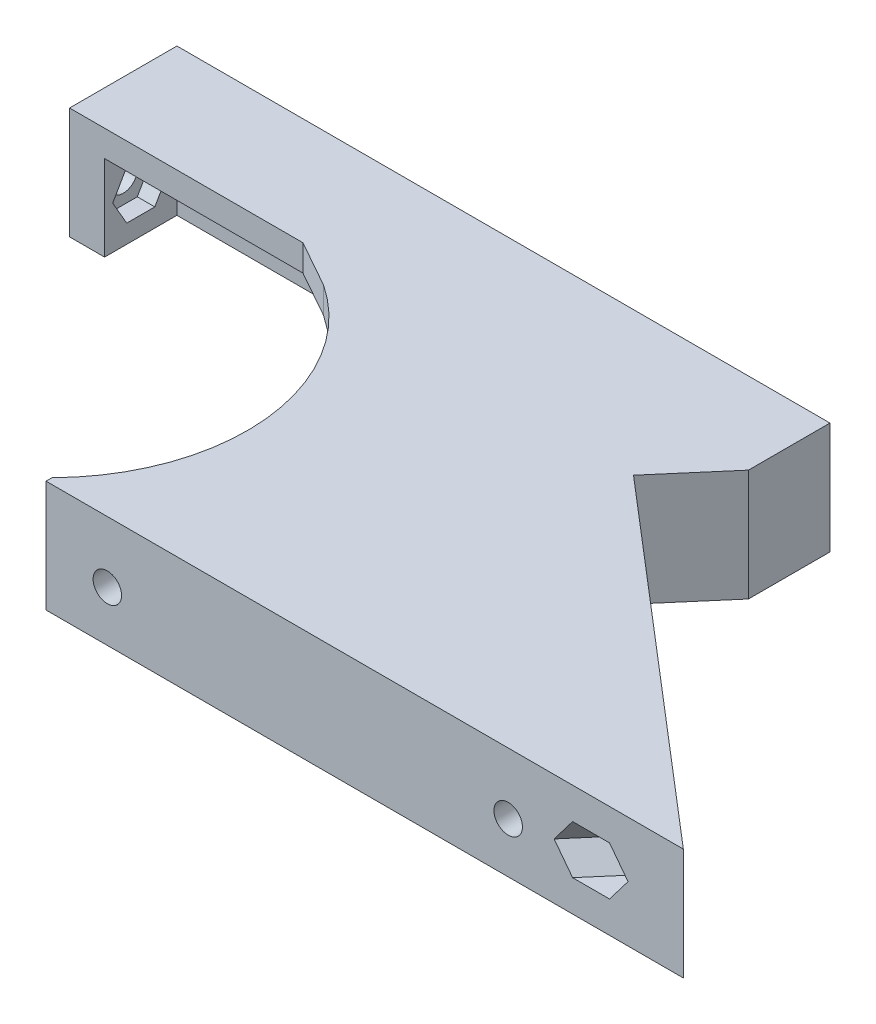
from build123d import *

# Parameters (mm, degrees)
SALIENTE_EXTRUIR1_DEPTH     = 12.75
CORTAR_EXTRUIR1_REACH       = 81.607
CROQUIS2_R                  = 1.625
CROQUIS3_R                  = 22.5
CORTAR_EXTRUIR2_DEPTH       = 80.607327513
SALIENTE_EXTRUIR2_DEPTH     = 3
SALIENTE_EXTRUIR3_DEPTH     = 9.75
CROQUIS6_R                  = 1.625
CORTAR_EXTRUIR3_DEPTH       = 10
CORTAR_EXTRUIR4_START       = -2
CORTAR_EXTRUIR4_DEPTH       = 10
CORTAR_EXTRUIR5_START       = -2
CORTAR_EXTRUIR5_DEPTH       = 10
CORTAR_EXTRUIR6_DEPTH       = 2
CORTAR_EXTRUIR7_REACH       = 83.869
CROQUIS10_R                 = 1.625
CORTAR_EXTRUIR8_DEPTH       = 2
CORTAR_EXTRUIR9_DEPTH       = 82.868914705
CORTAR_EXTRUIR9_DEPTH_BACK  = 82.868914705
CROQUIS12_W                 = 92.508691999
CROQUIS12_H                 = 24.255818813
SALIENTE_EXTRUIR4_DEPTH     = 12.75
CORTAR_EXTRUIR10_START      = -9.75
CORTAR_EXTRUIR10_DEPTH      = 9.75
CROQUIS16_W                 = 68.039065087
CROQUIS16_H                 = 12.75
CORTAR_EXTRUIR11_DEPTH      = 1
CORTAR_EXTRUIR12_DEPTH      = 111.665490574
CORTAR_EXTRUIR12_DEPTH_BACK = 111.665490574
CROQUIS17_W                 = 40.657498706
CROQUIS17_H                 = 22.934549925
SALIENTE_EXTRUIR5_REACH     = 98.215
CROQUIS18_W                 = 34.9120451
CROQUIS18_H                 = 3.951156815
CROQUIS20_R                 = 1.625
CORTAR_EXTRUIR14_DEPTH      = 10
CORTAR_EXTRUIR15_DEPTH      = 1.999995
CROQUIS22_R                 = 1.625
CORTAR_EXTRUIR16_DEPTH      = 10
CORTAR_EXTRUIR17_DEPTH      = 2
SALIENTE_EXTRUIR6_DEPTH     = 12.75
CORTAR_EXTRUIR18_DEPTH      = 2
CROQUIS28_R                 = 1.625
SALIENTE_EXTRUIR7_DEPTH     = 1
CORTAR_EXTRUIR19_REACH      = 127.295
CROQUIS29_R                 = 1.625
CORTAR_EXTRUIR20_DEPTH      = 2
SALIENTE_EXTRUIR11_DEPTH    = 12.75
CROQUIS41_R                 = 1.625
CORTAR_EXTRUIR25_DEPTH      = 10
SALIENTE_EXTRUIR12_DEPTH    = 12.75
SALIENTE_EXTRUIR13_DEPTH    = 12.75
CORTAR_EXTRUIR26_DEPTH      = 97.215343507
SALIENTE_EXTRUIR14_REACH    = 91.506
SALIENTE_EXTRUIR15_REACH    = 91.506
CORTAR_EXTRUIR27_REACH      = 122.22
CROQUIS47_R                 = 1.625
CORTAR_EXTRUIR28_REACH      = 124.22
CORTAR_EXTRUIR28_START      = -2
CORTAR_EXTRUIR29_START      = -9.75
CORTAR_EXTRUIR29_DEPTH      = 9.75
CORTAR_EXTRUIR30_REACH      = 91.506
CROQUIS50_R                 = 1.625
CORTAR_EXTRUIR31_REACH      = 93.506
CORTAR_EXTRUIR31_START      = -2
CORTAR_EXTRUIR13_DEPTH      = 99.717170878
CORTAR_EXTRUIR13_DEPTH_BACK = 99.717170878
CROQUIS19_W                 = 120.448667976
CROQUIS19_H                 = 32.886651308


with BuildPart() as part:
    # Croquis1 → Saliente-Extruir1 (new body)
    with BuildSketch(Plane(origin=(0, 0, 0), x_dir=(1, 0, 0), z_dir=(0, 1, 0))):
        Polygon((0, 0), (72.78319995, 0), (38.224450787, 29.62043043), (35.621353918, 26.5833452), (60.803074847, 5), (0, 5), align=None)
    extrude(amount=SALIENTE_EXTRUIR1_DEPTH)

    # Croquis2 → Cortar-Extruir1 (cut, up to next)
    with BuildSketch(Plane.XY, mode=Mode.PRIVATE) as cortar_extruir1_sk1:
        with Locations((52.78319995, 5.75)):
            Circle(CROQUIS2_R)
    cortar_extruir1_tool1 = extrude(cortar_extruir1_sk1.sketch, amount=-CORTAR_EXTRUIR1_REACH, mode=Mode.PRIVATE) & part.part
    # Croquis2 → Cortar-Extruir1 (cut, up to next)
    with BuildSketch(Plane.XY, mode=Mode.PRIVATE) as cortar_extruir1_sk2:
        with Locations((6.99999995, 5.75)):
            Circle(CROQUIS2_R)
    cortar_extruir1_tool2 = extrude(cortar_extruir1_sk2.sketch, amount=-CORTAR_EXTRUIR1_REACH, mode=Mode.PRIVATE) & part.part
    add(cortar_extruir1_tool1.solids().sort_by_distance((52.7832, 5.75, 0))[0], mode=Mode.SUBTRACT)
    add(cortar_extruir1_tool2.solids().sort_by_distance((7, 5.75, 0))[0], mode=Mode.SUBTRACT)

    # Croquis3 → Cortar-Extruir2 (cut, through all)
    with BuildSketch(Plane(origin=(0, 12.75, 0), x_dir=(1, 0, 0), z_dir=(0, 1, 0))):
        with Locations((-16, 16.5)):
            Circle(CROQUIS3_R)
    extrude(amount=-CORTAR_EXTRUIR2_DEPTH, mode=Mode.SUBTRACT)

    # Croquis4 → Saliente-Extruir2 (add)
    with BuildSketch(Plane(origin=(0, 12.75, 0), x_dir=(1, 0, 0), z_dir=(0, 1, 0))):
        with BuildLine():
            Line((38.224450787, 29.62043043), (31.656319269, 35.25))
            Line((31.656319269, 35.25), (-3.562657036, 35.25))
            ThreePointArc((-3.562657036, 35.25), (5.936291456, 21.504909307), (3.339079606, 5))
            Line((3.339079606, 5), (60.803074847, 5))
            Line((60.803074847, 5), (35.621353918, 26.5833452))
            Line((35.621353918, 26.5833452), (38.224450787, 29.62043043))
        make_face()
    extrude(amount=-SALIENTE_EXTRUIR2_DEPTH)

    # Croquis5 → Saliente-Extruir3 (add)
    with BuildSketch(Plane.XZ.offset(-9.75)):
        with BuildLine():
            Line((-3.562657036, -35.25), (31.656319269, -35.25))
            Line((31.656319269, -35.25), (38.224450787, -29.62043043))
            Line((38.224450787, -29.62043043), (35.621353918, -26.5833452))
            Line((35.621353918, -26.5833452), (30.17667434, -31.25))
            Line((30.17667434, -31.25), (0.990806338, -31.25))
            ThreePointArc((0.990806338, -31.25), (-1.15062315, -33.404023402), (-3.562657036, -35.25))
        make_face()
    extrude(amount=SALIENTE_EXTRUIR3_DEPTH)

    # Croquis6 → Cortar-Extruir3 (cut)
    with BuildSketch(Plane(origin=(30.824200619, 0, -35.963211942), x_dir=(-0.7592713073348843, 0, -0.6507742172658468), z_dir=(0.6507742172658468, 0, -0.7592713073348843))):
        with Locations((-47.262195378, 6.375)):
            Circle(CROQUIS6_R)
        with Locations((-7.442195378, 6.375)):
            Circle(CROQUIS6_R)
    extrude(amount=-CORTAR_EXTRUIR3_DEPTH, mode=Mode.SUBTRACT)

    # Croquis7 → Cortar-Extruir4 (cut)
    with BuildSketch(Plane(origin=(28.22110375, 0, -32.926126712), x_dir=(0.7592713073348848, 0, 0.6507742172658464), z_dir=(-0.6507742172658463, 0, 0.7592713073348847)).offset(CORTAR_EXTRUIR4_START)):
        Polygon((48.864342375, 3.6), (50.466489372, 6.375), (48.864342375, 9.15), (45.660048381, 9.15), (44.057901384, 6.375), (45.660048381, 3.6), align=None)
    extrude(amount=CORTAR_EXTRUIR4_DEPTH, mode=Mode.SUBTRACT)

    # Croquis8 → Cortar-Extruir5 (cut)
    with BuildSketch(Plane(origin=(28.22110375, 0, -32.926126712), x_dir=(0.7592713073348848, 0, 0.6507742172658464), z_dir=(-0.6507742172658463, 0, 0.7592713073348847)).offset(CORTAR_EXTRUIR5_START)):
        Polygon((9.044342375, 3.6), (10.646489372, 6.375), (9.044342375, 9.15), (5.840048381, 9.15), (4.237901384, 6.375), (5.840048381, 3.6), align=None)
    extrude(amount=CORTAR_EXTRUIR5_DEPTH, mode=Mode.SUBTRACT)

    # Croquis9 → Cortar-Extruir6 (cut)
    with BuildSketch(Plane(origin=(0, 0, -5), x_dir=(-1, 0, 0), z_dir=(0, 0, -1))):
        Polygon((-5.397852953, 2.975), (-3.795705956, 5.75), (-5.397852953, 8.525), (-8.602146947, 8.525), (-10.204293944, 5.75), (-8.602146947, 2.975), align=None)
        Polygon((-51.181052953, 2.975), (-49.578905956, 5.75), (-51.181052953, 8.525), (-54.385346947, 8.525), (-55.987493944, 5.75), (-54.385346947, 2.975), align=None)
    extrude(amount=-CORTAR_EXTRUIR6_DEPTH, mode=Mode.SUBTRACT)

    # Croquis10 → Cortar-Extruir7 (cut, up to next)
    with BuildSketch(Plane(origin=(0, 0, -35.25), x_dir=(-1, 0, 0), z_dir=(0, 0, -1)), mode=Mode.PRIVATE) as cortar_extruir7_sk1:
        with Locations((-21.656319269, 6.375)):
            Circle(CROQUIS10_R)
    cortar_extruir7_tool1 = extrude(cortar_extruir7_sk1.sketch, amount=-CORTAR_EXTRUIR7_REACH, mode=Mode.PRIVATE) & part.part
    add(cortar_extruir7_tool1.solids().sort_by_distance((21.656319, 6.375, -35.25))[0], mode=Mode.SUBTRACT)

    # Croquis11 → Cortar-Extruir8 (cut)
    with BuildSketch(Plane.XY.offset(-31.25)):
        Polygon((23.258466266, 3.6), (24.860613263, 6.375), (23.258466266, 9.15), (20.054172272, 9.15), (18.452025275, 6.375), (20.054172272, 3.6), align=None)
    extrude(amount=-CORTAR_EXTRUIR8_DEPTH, mode=Mode.SUBTRACT)

    # Simetría1: part across plane


with BuildPart() as part_1:
    add(part.part)
    add(part.part.mirror(Plane.ZX))

    # Croquis12 → Cortar-Extruir9 (cut, two sides: drawn at the far end of the back side and taken through both)
    with BuildSketch(Plane(origin=(0, 0, -35.25), x_dir=(-1, 0, 0), z_dir=(0, 0, -1)).offset(-CORTAR_EXTRUIR9_DEPTH_BACK)):
        with Locations((-33.077560565, 12.127909407)):
            Rectangle(CROQUIS12_W, CROQUIS12_H)
    extrude(amount=CORTAR_EXTRUIR9_DEPTH + CORTAR_EXTRUIR9_DEPTH_BACK, mode=Mode.SUBTRACT)

    # Croquis13 → Saliente-Extruir4 (add)
    with BuildSketch(Plane.XZ.offset(12.75)):
        Polygon((-35.562657036, -82.38260805), (-35.562657036, -38.25), (-8.913300435, -38.25), (-3.562657036, -35.25), (31.656319269, -35.25), (0.000162281, -62.38260805), align=None)
    extrude(amount=-SALIENTE_EXTRUIR4_DEPTH)

    # Croquis14 → Cortar-Extruir10 (cut)
    with BuildSketch(Plane(origin=(0, 0, 0), x_dir=(1, 0, 0), z_dir=(0, 1, 0)).offset(CORTAR_EXTRUIR10_START)):
        Polygon((30.17667434, 31.25), (0.990806338, 31.25), (-31.562657036, 38.25), (-31.562657036, 75.543902968), (-2.303881466, 59.089203295), align=None)
    extrude(amount=CORTAR_EXTRUIR10_DEPTH, mode=Mode.SUBTRACT)

    # Croquis16 → Cortar-Extruir11 (cut)
    with BuildSketch(Plane(origin=(30.824200619, 0, -35.963211942), x_dir=(-0.7592713073348843, 0, -0.6507742172658468), z_dir=(0.6507742172658468, 0, -0.7592713073348843))):
        with Locations((6.577337166, -6.375)):
            Rectangle(CROQUIS16_W, CROQUIS16_H)
    extrude(amount=-CORTAR_EXTRUIR11_DEPTH, mode=Mode.SUBTRACT)

    # Croquis17 → Cortar-Extruir12 (cut, two sides: drawn at the far end of the back side and taken through both)
    with BuildSketch(Plane.XZ.offset(12.75).offset(-CORTAR_EXTRUIR12_DEPTH_BACK)):
        with Locations((-20.328587072, -73.090611706)):
            Rectangle(CROQUIS17_W, CROQUIS17_H)
    extrude(amount=CORTAR_EXTRUIR12_DEPTH + CORTAR_EXTRUIR12_DEPTH_BACK, mode=Mode.SUBTRACT)

    # Croquis18 → Saliente-Extruir5 (add, up to next)
    with BuildSketch(Plane(origin=(0, 0, 0), x_dir=(1, 0, 0), z_dir=(0, 1, 0)), mode=Mode.PRIVATE) as saliente_extruir5_sk1:
        with Locations((-18.106634486, 59.647758336)):
            Rectangle(CROQUIS18_W, CROQUIS18_H)
    saliente_extruir5_tool1 = extrude(saliente_extruir5_sk1.sketch, amount=-SALIENTE_EXTRUIR5_REACH, mode=Mode.PRIVATE) - part_1.part
    add(saliente_extruir5_tool1.solids().sort_by_distance((-18.106634, 0, -59.647758))[0])

    # Croquis20 → Cortar-Extruir14 (cut)
    with BuildSketch(Plane(origin=(30.173426402, 0, -35.203940634), x_dir=(-0.7592713073348842, 0, -0.6507742172658472), z_dir=(0.6507742172658472, 0, -0.7592713073348842))):
        with Locations((25.596869709, -6.375)):
            Circle(CROQUIS20_R)
        with Locations((-7.442195378, -6.375)):
            Circle(CROQUIS20_R)
    extrude(amount=-CORTAR_EXTRUIR14_DEPTH, mode=Mode.SUBTRACT)

    # Croquis21 → Cortar-Extruir15 (cut)
    with BuildSketch(Plane(origin=(28.22110375, 0, -32.926126712), x_dir=(0.7592713073348848, 0, 0.6507742172658464), z_dir=(-0.6507742172658463, 0, 0.7592713073348847))):
        Polygon((-23.994722712, -9.15), (-22.392575715, -6.375), (-23.994722712, -3.6), (-27.199016706, -3.6), (-28.801163703, -6.375), (-27.199016706, -9.15), align=None)
    extrude(amount=-CORTAR_EXTRUIR15_DEPTH, mode=Mode.SUBTRACT)

    # Croquis22 → Cortar-Extruir16 (cut)
    with BuildSketch(Plane(origin=(0, 0, -61.623336743), x_dir=(-1, 0, 0), z_dir=(0, 0, -1))):
        with Locations((18.112657036, -6.375)):
            Circle(CROQUIS22_R)
    extrude(amount=-CORTAR_EXTRUIR16_DEPTH, mode=Mode.SUBTRACT)

    # Croquis23 → Cortar-Extruir17 (cut)
    with BuildSketch(Plane.XY.offset(-57.672179928)):
        Polygon((-16.510510039, -9.15), (-14.908363042, -6.375), (-16.510510039, -3.6), (-19.714804033, -3.6), (-21.31695103, -6.375), (-19.714804033, -9.15), align=None)
    extrude(amount=-CORTAR_EXTRUIR17_DEPTH, mode=Mode.SUBTRACT)

    # Croquis26 → Saliente-Extruir6 (add)
    with BuildSketch(Plane(origin=(0, 0, 0), x_dir=(1, 0, 0), z_dir=(0, 1, 0))):
        Polygon((60.803074847, 5), (-2.287792345, 59.07541325), (-2.938566562, 58.316141943), (60.15230063, 4.240728693), align=None)
    extrude(amount=-SALIENTE_EXTRUIR6_DEPTH)

    # Croquis27 → Cortar-Extruir18 (cut)
    with BuildSketch(Plane(origin=(27.570329533, 0, -32.166855405), x_dir=(0.7592713073348847, 0, 0.6507742172658465), z_dir=(-0.6507742172658465, 0, 0.7592713073348848))):
        Polygon((-22.421443229, -6.375), (-24.009156469, -3.625), (-27.184582949, -3.625), (-28.77229619, -6.375), (-27.184582949, -9.125), (-24.009156469, -9.125), align=None)
        Polygon((10.646489372, -6.375), (9.044342375, -3.6), (5.840048381, -3.6), (4.237901384, -6.375), (5.840048381, -9.15), (9.044342375, -9.15), align=None)
    extrude(amount=-CORTAR_EXTRUIR18_DEPTH, mode=Mode.SUBTRACT)

    # Croquis28 → Saliente-Extruir7 (add)
    # profile 1 of 2: a face of its own
    with BuildSketch(Plane(origin=(29.522652185, 0, -34.444669327), x_dir=(0.7592713073348847, 0, 0.6507742172658465), z_dir=(-0.6507742172658465, 0, 0.7592713073348848))):
        Polygon((-24.009156469, -3.625), (-27.184582949, -3.625), (-28.77229619, -6.375), (-27.184582949, -9.125), (-24.009156469, -9.125), (-22.421443229, -6.375), align=None)
        with Locations(Location((-25.596869709, -6.375, 0), (0, 0, 180))):
            Circle(CROQUIS28_R, mode=Mode.SUBTRACT)
    # profile 2 of 2: a face of its own
    with BuildSketch(Plane(origin=(29.522652185, 0, -34.444669327), x_dir=(0.7592713073348847, 0, 0.6507742172658465), z_dir=(-0.6507742172658465, 0, 0.7592713073348848))):
        Polygon((10.646489372, -6.375), (9.044342375, -3.6), (5.840048381, -3.6), (4.237901384, -6.375), (5.840048381, -9.15), (9.044342375, -9.15), align=None)
        with Locations(Location((7.442195378, -6.375, 0), (0, 0, 180))):
            Circle(CROQUIS28_R, mode=Mode.SUBTRACT)
    extrude(amount=SALIENTE_EXTRUIR7_DEPTH)

    # Croquis29 → Cortar-Extruir19 (cut, up to next)
    with BuildSketch(Plane.ZY.offset(35.562657036), mode=Mode.PRIVATE) as cortar_extruir19_sk1:
        with Locations((-51.623336743, -6.375)):
            Circle(CROQUIS29_R)
    cortar_extruir19_tool1 = extrude(cortar_extruir19_sk1.sketch, amount=-CORTAR_EXTRUIR19_REACH, mode=Mode.PRIVATE) & part_1.part
    add(cortar_extruir19_tool1.solids().sort_by_distance((-35.562657, -6.375, -51.623337))[0], mode=Mode.SUBTRACT)

    # Croquis30 → Cortar-Extruir20 (cut)
    with BuildSketch(Plane(origin=(-31.562657036, 0, 0), x_dir=(0, 0, -1), z_dir=(1, 0, 0))):
        Polygon((53.22548374, -9.15), (54.827630737, -6.375), (53.22548374, -3.6), (50.021189746, -3.6), (48.419042749, -6.375), (50.021189746, -9.15), align=None)
    extrude(amount=-CORTAR_EXTRUIR20_DEPTH, mode=Mode.SUBTRACT)

    # Croquis40 → Saliente-Extruir11 (add)
    with BuildSketch(Plane.XZ.offset(12.75)):
        Polygon((51.009497963, -17.345267417), (-0.650611936, -61.623336743), (0.886019316, -61.623336743), (51.66027218, -18.104538724), align=None)
    extrude(amount=-SALIENTE_EXTRUIR11_DEPTH)

    # Croquis41 → Cortar-Extruir25 (cut)
    with BuildSketch(Plane(origin=(30.824200619, 0, -35.963211942), x_dir=(-0.7592713073348843, 0, -0.6507742172658468), z_dir=(0.6507742172658468, 0, -0.7592713073348843))):
        with Locations((-7.442195378, -6.375)):
            Circle(CROQUIS41_R)
        with Locations((25.596869709, -6.375)):
            Circle(CROQUIS41_R)
    extrude(amount=-CORTAR_EXTRUIR25_DEPTH, mode=Mode.SUBTRACT)

    # Croquis42 → Saliente-Extruir12 (add)
    with BuildSketch(Plane.XZ.offset(12.75)):
        Polygon((32.95941988, -34.133107696), (39.018127843, -41.201923567), (24.71209089, -41.201923567), align=None)
    extrude(amount=-SALIENTE_EXTRUIR12_DEPTH)

    # Croquis43 → Saliente-Extruir13 (add)
    with BuildSketch(Plane.XZ.offset(12.75)):
        Polygon((39.018127843, -41.201923567), (39.018127843, -50.511923567), (13.849927511, -50.511923567), (24.71209089, -41.201923567), align=None)
    extrude(amount=-SALIENTE_EXTRUIR13_DEPTH)

    # Croquis44 → Cortar-Extruir26 (cut, through all)
    with BuildSketch(Plane.XZ.offset(12.75)):
        Polygon((13.849927511, -50.511923567), (-35.562657036, -50.511923567), (-35.562657036, -61.623336743), (0.886019316, -61.623336743), align=None)
    extrude(amount=-CORTAR_EXTRUIR26_DEPTH, mode=Mode.SUBTRACT)

    # Croquis45 → Saliente-Extruir14 (add, up to next)
    with BuildSketch(Plane(origin=(0, 0, 0), x_dir=(1, 0, 0), z_dir=(0, 1, 0)), mode=Mode.PRIVATE) as saliente_extruir14_sk1:
        Polygon((6.166771253, 50.511923567), (21.724093533, 50.511923567), (21.724093533, 37.177685684), align=None)
    saliente_extruir14_tool1 = extrude(saliente_extruir14_sk1.sketch, amount=-SALIENTE_EXTRUIR14_REACH, mode=Mode.PRIVATE) - part_1.part
    add(saliente_extruir14_tool1.solids().sort_by_distance((16.538319, 0, -46.067178))[0])

    # Croquis46 → Saliente-Extruir15 (add, up to next)
    with BuildSketch(Plane(origin=(0, 0, 0), x_dir=(1, 0, 0), z_dir=(0, 1, 0)), mode=Mode.PRIVATE) as saliente_extruir15_sk1:
        Polygon((-35.562657036, 50.511923567), (-31.562657036, 50.511923567), (10.83365133, 50.511923567), (10.83365133, 46.511923567), (-31.562657036, 46.511923567), (-31.562657036, 38.25), (-35.562657036, 38.25), align=None)
    saliente_extruir15_tool1 = extrude(saliente_extruir15_sk1.sketch, amount=-SALIENTE_EXTRUIR15_REACH, mode=Mode.PRIVATE) - part_1.part
    add(saliente_extruir15_tool1.solids().sort_by_distance((-15.568733, 0, -47.585191))[0])

    # Croquis47 → Cortar-Extruir27 (cut, up to next)
    with BuildSketch(Plane.ZY.offset(35.562657036), mode=Mode.PRIVATE) as cortar_extruir27_sk1:
        with Locations((-42.380961783, -4.875)):
            Circle(CROQUIS47_R)
    cortar_extruir27_tool1 = extrude(cortar_extruir27_sk1.sketch, amount=-CORTAR_EXTRUIR27_REACH, mode=Mode.PRIVATE) & part_1.part
    add(cortar_extruir27_tool1.solids().sort_by_distance((-35.562657, -4.875, -42.380962))[0], mode=Mode.SUBTRACT)

    # Croquis48 → Cortar-Extruir28 (cut, up to next)
    with BuildSketch(Plane.ZY.offset(35.562657036).offset(CORTAR_EXTRUIR28_START), mode=Mode.PRIVATE) as cortar_extruir28_sk1:
        Polygon((-40.778814786, -7.65), (-39.176667789, -4.875), (-40.778814786, -2.1), (-43.98310878, -2.1), (-45.585255777, -4.875), (-43.98310878, -7.65), align=None)
    cortar_extruir28_tool1 = extrude(cortar_extruir28_sk1.sketch, amount=-CORTAR_EXTRUIR28_REACH, mode=Mode.PRIVATE) & part_1.part
    add(cortar_extruir28_tool1.solids().sort_by_distance((-33.562657, -4.875, -42.380962))[0], mode=Mode.SUBTRACT)

    # Croquis49 → Cortar-Extruir29 (cut)
    with BuildSketch(Plane(origin=(0, 0, 0), x_dir=(1, 0, 0), z_dir=(0, 1, 0)).offset(CORTAR_EXTRUIR29_START)):
        Polygon((26.668463565, 32.939848028), (35.018127843, 42.681568496), (35.018127843, 46.511923567), (10.83365133, 46.511923567), align=None)
    extrude(amount=CORTAR_EXTRUIR29_DEPTH, mode=Mode.SUBTRACT)

    # Croquis50 → Cortar-Extruir30 (cut, up to next)
    with BuildSketch(Plane(origin=(0, 0, -50.511923567), x_dir=(-1, 0, 0), z_dir=(0, 0, -1)), mode=Mode.PRIVATE) as cortar_extruir30_sk1:
        with Locations((25.562657036, -6.75)):
            Circle(CROQUIS50_R)
    cortar_extruir30_tool1 = extrude(cortar_extruir30_sk1.sketch, amount=-CORTAR_EXTRUIR30_REACH, mode=Mode.PRIVATE) & part_1.part
    # Croquis50 → Cortar-Extruir30 (cut, up to next)
    with BuildSketch(Plane(origin=(0, 0, -50.511923567), x_dir=(-1, 0, 0), z_dir=(0, 0, -1)), mode=Mode.PRIVATE) as cortar_extruir30_sk2:
        with Locations((-24.437342964, -6.75)):
            Circle(CROQUIS50_R)
    cortar_extruir30_tool2 = extrude(cortar_extruir30_sk2.sketch, amount=-CORTAR_EXTRUIR30_REACH, mode=Mode.PRIVATE) & part_1.part
    add(cortar_extruir30_tool1.solids().sort_by_distance((-25.562657, -6.75, -50.511924))[0], mode=Mode.SUBTRACT)
    add(cortar_extruir30_tool2.solids().sort_by_distance((24.437343, -6.75, -50.511924))[0], mode=Mode.SUBTRACT)

    # Croquis51 → Cortar-Extruir31 (cut, up to next)
    with BuildSketch(Plane(origin=(0, 0, -50.511923567), x_dir=(-1, 0, 0), z_dir=(0, 0, -1)).offset(CORTAR_EXTRUIR31_START), mode=Mode.PRIVATE) as cortar_extruir31_sk1:
        Polygon((-22.835195967, -9.525), (-21.23304897, -6.75), (-22.835195967, -3.975), (-26.039489961, -3.975), (-27.641636958, -6.75), (-26.039489961, -9.525), align=None)
    cortar_extruir31_tool1 = extrude(cortar_extruir31_sk1.sketch, amount=-CORTAR_EXTRUIR31_REACH, mode=Mode.PRIVATE) & part_1.part
    # Croquis51 → Cortar-Extruir31 (cut, up to next)
    with BuildSketch(Plane(origin=(0, 0, -50.511923567), x_dir=(-1, 0, 0), z_dir=(0, 0, -1)).offset(CORTAR_EXTRUIR31_START), mode=Mode.PRIVATE) as cortar_extruir31_sk2:
        Polygon((27.164804033, -9.525), (28.76695103, -6.75), (27.164804033, -3.975), (23.960510039, -3.975), (22.358363042, -6.75), (23.960510039, -9.525), align=None)
    cortar_extruir31_tool2 = extrude(cortar_extruir31_sk2.sketch, amount=-CORTAR_EXTRUIR31_REACH, mode=Mode.PRIVATE) & part_1.part
    add(cortar_extruir31_tool1.solids().sort_by_distance((24.437343, -6.75, -48.511924))[0], mode=Mode.SUBTRACT)
    add(cortar_extruir31_tool2.solids().sort_by_distance((-25.562657, -6.75, -48.511924))[0], mode=Mode.SUBTRACT)

    # Simetría2: part across face


with BuildPart() as part_2:
    add(part_1.part)
    add(part_1.part.mirror(Plane(origin=(19.502677982, -12.75, -25.93599085), x_dir=(0, 0, 1), z_dir=(0, -1, 0))))

    # Croquis19 → Cortar-Extruir13 (cut, two sides: drawn at the far end of the back side and taken through both)
    with BuildSketch(Plane(origin=(0, 0, -61.623336743), x_dir=(-1, 0, 0), z_dir=(0, 0, -1)).offset(-CORTAR_EXTRUIR13_DEPTH_BACK)):
        with Locations((-18.558865962, 3.693325654)):
            Rectangle(CROQUIS19_W, CROQUIS19_H)
    extrude(amount=CORTAR_EXTRUIR13_DEPTH + CORTAR_EXTRUIR13_DEPTH_BACK, mode=Mode.SUBTRACT)


solid = part_2.part
